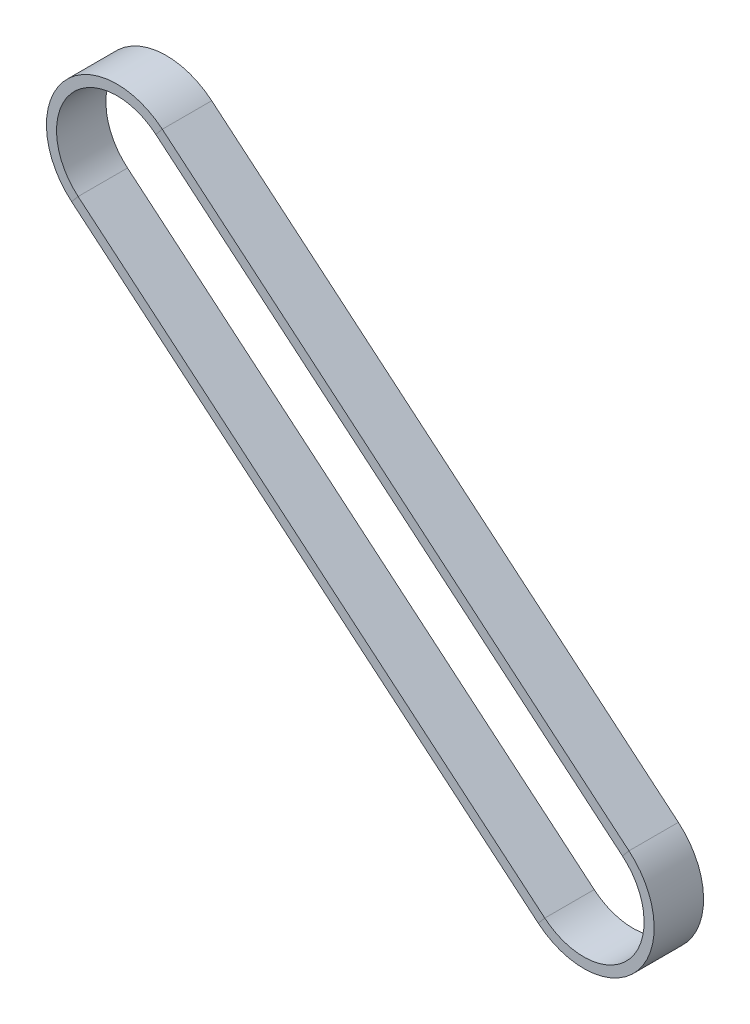
from build123d import *

# Parameters (mm, degrees)
SKETCH3_W = 15
SKETCH3_H = 3.06


with BuildPart() as part:
    # Sweep2: sweep along a path in Sketch2
    with BuildLine(Plane.XY) as sweep2_path:
        Line((-13.177145999, -15.703911084), (-154.895367976, 103.211796708))
        ThreePointArc((-154.895367976, 103.211796708), (-157.422133061, 132.092853791), (-128.541075978, 134.619618876))
        Line((-128.541075978, 134.619618876), (13.177145999, 15.703911084))
        ThreePointArc((13.177145999, 15.703911084), (15.703911084, -13.177145999), (-13.177145999, -15.703911084))
    # Sketch3 → Sweep2 (sweep)
    with BuildSketch(Plane(origin=(13.177145999, 15.703911084, 0), x_dir=(0, 0, -1), z_dir=(0.766044443118977, -0.6427876096865406, 0))):
        with Locations((0, -0.613265054)):
            Rectangle(SKETCH3_W, SKETCH3_H)
    sweep(path=sweep2_path.line)


solid = part.part
